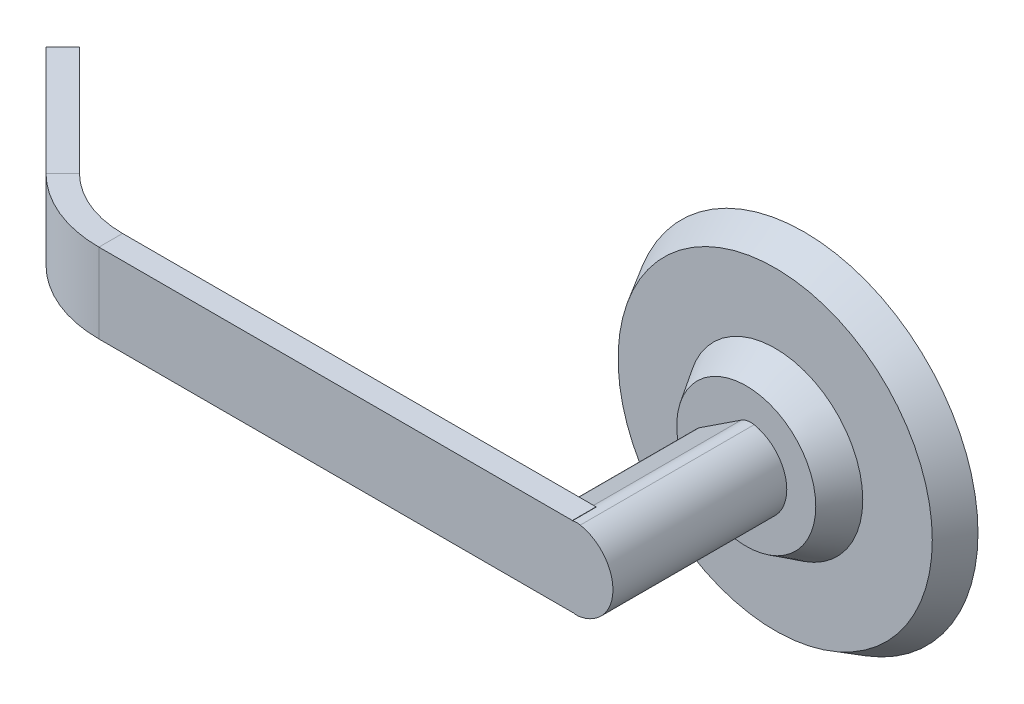
from build123d import *

# Parameters (mm, degrees)
BOSS_EXTRUDE1_DEPTH = 38.1
SKETCH3_W           = 5.185673946
SKETCH3_H           = 17.43749126


with BuildPart() as part:
    # Sketch1 → Revolve1 (revolve)
    with BuildSketch(Plane(origin=(0, 0, 0), x_dir=(1, 0, 0), z_dir=(0, 1, 0))):
        Polygon((0, 0), (0, 12.7), (38.1, 12.7), (34.433825791, 6.35), (19.193825791, 6.35), (15.24, 0), align=None)
    revolve(axis=Axis((0, 0, 0), (0, 0, -1)))

    # Sketch2 → Boss-Extrude1 (add)
    with BuildSketch(Plane.XY):
        with BuildLine():
            Line((-1.101928038, 8.164948968), (-10.28615812, 2.121872405))
            ThreePointArc((-10.28615812, 2.121872405), (-11.43, 0), (-10.28615812, -2.121872405))
            Line((-10.28615812, -2.121872405), (-1.101928038, -8.164948968))
            ThreePointArc((-1.101928038, -8.164948968), (0.26271934, -8.721632133), (1.736540998, -8.71874563))
            ThreePointArc((1.736540998, -8.71874563), (8.89, 0), (1.736540998, 8.71874563))
            ThreePointArc((1.736540998, 8.71874563), (0.26271934, 8.721632133), (-1.101928038, 8.164948968))
        make_face()
    extrude(amount=BOSS_EXTRUDE1_DEPTH)

    # Sweep1: sweep along a path in Sketch4
    with BuildLine(Plane(origin=(0, 0, 0), x_dir=(1, 0, 0), z_dir=(0, 1, 0))) as sweep1_path:
        Line((0, -35.507163027), (-103.778975516, -35.507163027))
        ThreePointArc((-103.778975516, -35.507163027), (-113.499134698, -33.573703153), (-121.739487758, -28.067675269))
        Line((-121.739487758, -28.067675269), (-145.730896424, -4.076266603))
    # Sketch3 → Sweep1 (sweep)
    with BuildSketch(Plane(origin=(0, 0, 0), x_dir=(0, 0, -1), z_dir=(1, 0, 0))):
        with Locations((-35.507163027, 0)):
            Rectangle(SKETCH3_W, SKETCH3_H)
    sweep(path=sweep1_path.line)


solid = part.part
